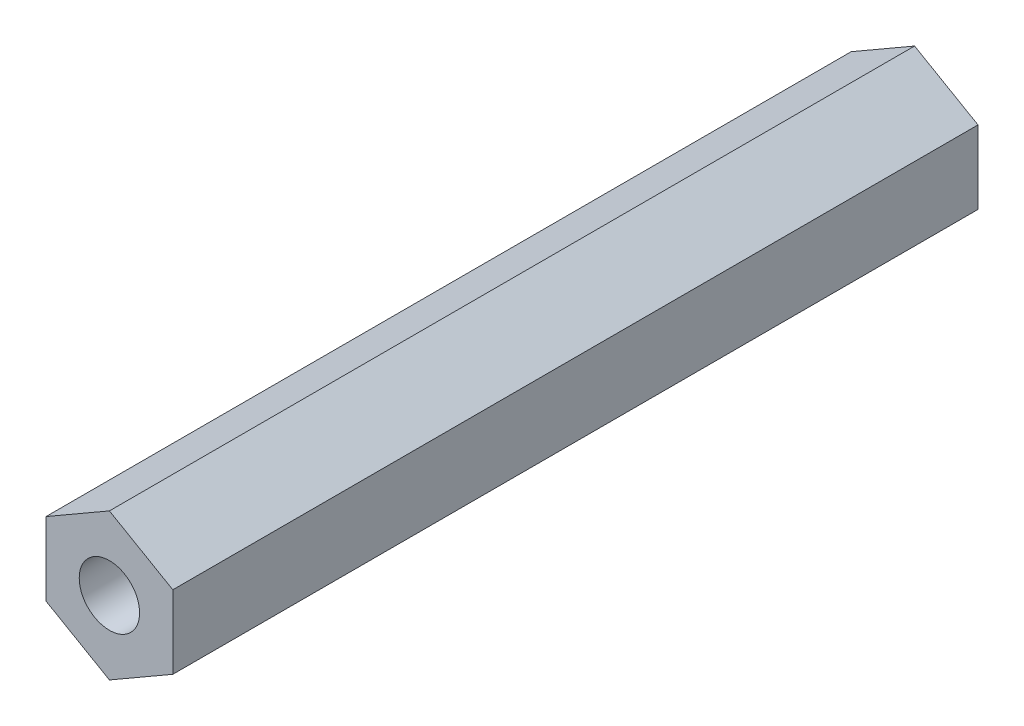
from build123d import *

# Parameters (mm, degrees)
BOSS_EXTRU_1_DEPTH      = 32
ESQUISSE2_R             = 1.2
ENL_V_MAT_EXTRU_1_DEPTH = 32


with BuildPart() as part:
    # Esquisse1 → Boss.-Extru.1 (new body)
    with BuildSketch(Plane.XY):
        Polygon((-2.52, 1.454922678), (-2.52, -1.454922678), (0, -2.909845357), (2.52, -1.454922678), (2.52, 1.454922678), (0, 2.909845357), align=None)
    extrude(amount=BOSS_EXTRU_1_DEPTH)

    # Esquisse2 → Enlèv. mat.-Extru.1 (cut)
    with BuildSketch(Plane(origin=(0, 0, 0), x_dir=(-1, 0, 0), z_dir=(0, 0, -1))):
        Circle(ESQUISSE2_R)
    extrude(amount=-ENL_V_MAT_EXTRU_1_DEPTH, mode=Mode.SUBTRACT)


solid = part.part
